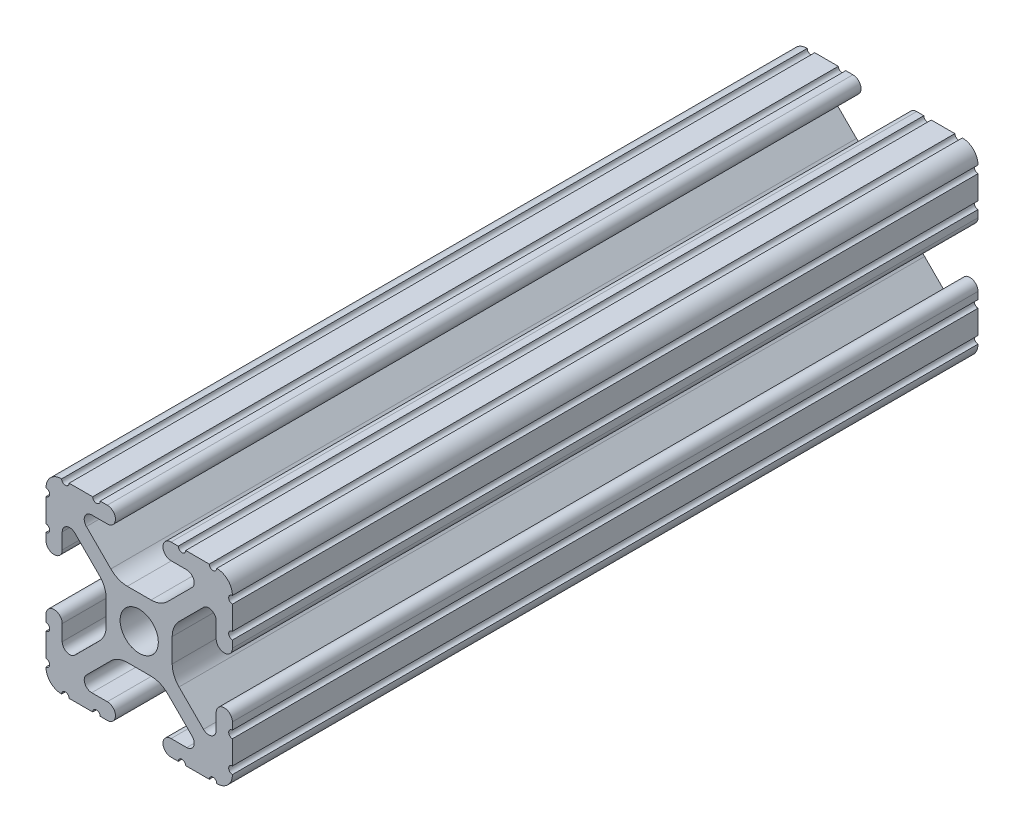
from build123d import *

# Parameters (mm, degrees)
SKETCH1_R           = 2.6035
BOSS_EXTRUDE1_DEPTH = 101.6


with BuildPart() as part:
    # Sketch1 → Boss-Extrude1 (new body)
    with BuildSketch(Plane(origin=(0, 0, -101.6), x_dir=(-1, 0, 0), z_dir=(0, 0, -1))):
        with BuildLine():
            Line((12.7, -9.5504), (12.7, -6.3330836))
            ThreePointArc((12.7, -6.3330836), (12.192, -5.8250836), (12.7, -5.3170836))
            Line((12.7, -5.3170836), (12.7, -4.3434))
            ThreePointArc((12.7, -4.3434), (11.5951, -3.2385), (10.4902, -4.3434))
            Line((10.4902, -4.3434), (10.4902, -6.474794456))
            ThreePointArc((10.4902, -6.474794456), (9.863006367, -7.413456061), (8.75577951, -7.193214945))
            Line((8.75577951, -7.193214945), (5.42573597, -3.863171405))
            ThreePointArc((5.42573597, -3.863171405), (4.737482484, -2.833127272), (4.4958, -1.618107374))
            Line((4.4958, -1.618107374), (4.4958, 1.618107374))
            ThreePointArc((4.4958, 1.618107374), (4.737482484, 2.833127272), (5.42573597, 3.863171405))
            Line((5.42573597, 3.863171405), (8.75577951, 7.193214945))
            ThreePointArc((8.75577951, 7.193214945), (9.863006367, 7.413456061), (10.4902, 6.474794456))
            Line((10.4902, 6.474794456), (10.4902, 4.343399971))
            ThreePointArc((10.4902, 4.343399971), (11.5951, 3.238499971), (12.7, 4.343399971))
            Line((12.7, 4.343399971), (12.7, 5.3170836))
            ThreePointArc((12.7, 5.3170836), (12.192, 5.8250836), (12.7, 6.3330836))
            Line((12.7, 6.3330836), (12.7, 9.5504))
            ThreePointArc((12.7, 9.5504), (12.192000006, 10.058323491), (12.699846982, 10.566399977))
            ThreePointArc((12.699846982, 10.566399977), (12.082522516, 12.082522516), (10.566399977, 12.699846982))
            ThreePointArc((10.566399977, 12.699846982), (10.058323491, 12.192000006), (9.5504, 12.7))
            Line((9.5504, 12.7), (6.3330836, 12.7))
            ThreePointArc((6.3330836, 12.7), (5.8250836, 12.192), (5.3170836, 12.7))
            Line((5.3170836, 12.7), (4.3434, 12.7))
            ThreePointArc((4.3434, 12.7), (3.2385, 11.5951), (4.3434, 10.4902))
            Line((4.3434, 10.4902), (6.474794456, 10.4902))
            ThreePointArc((6.474794456, 10.4902), (7.413456061, 9.863006367), (7.193214945, 8.75577951))
            Line((7.193214945, 8.75577951), (3.863171405, 5.42573597))
            ThreePointArc((3.863171405, 5.42573597), (2.833127272, 4.737482484), (1.618107374, 4.4958))
            Line((1.618107374, 4.4958), (-1.618107374, 4.4958))
            ThreePointArc((-1.618107374, 4.4958), (-2.833127272, 4.737482484), (-3.863171405, 5.42573597))
            Line((-3.863171405, 5.42573597), (-7.193214945, 8.75577951))
            ThreePointArc((-7.193214945, 8.75577951), (-7.413456061, 9.863006367), (-6.474794456, 10.4902))
            Line((-6.474794456, 10.4902), (-4.343399971, 10.4902))
            ThreePointArc((-4.343399971, 10.4902), (-3.238499971, 11.5951), (-4.343399971, 12.7))
            Line((-4.343399971, 12.7), (-5.3170836, 12.7))
            ThreePointArc((-5.3170836, 12.7), (-5.8250836, 12.192), (-6.3330836, 12.7))
            Line((-6.3330836, 12.7), (-9.5504, 12.7))
            ThreePointArc((-9.5504, 12.7), (-10.058323491, 12.192000006), (-10.566399977, 12.699846982))
            ThreePointArc((-10.566399977, 12.699846982), (-12.082522516, 12.082522516), (-12.699846982, 10.566399977))
            ThreePointArc((-12.699846982, 10.566399977), (-12.192000006, 10.058323491), (-12.7, 9.5504))
            Line((-12.7, 9.5504), (-12.7, 6.3330836))
            ThreePointArc((-12.7, 6.3330836), (-12.192, 5.8250836), (-12.7, 5.3170836))
            Line((-12.7, 5.3170836), (-12.7, 4.3434))
            ThreePointArc((-12.7, 4.3434), (-11.5951, 3.2385), (-10.4902, 4.3434))
            Line((-10.4902, 4.3434), (-10.4902, 6.474794456))
            ThreePointArc((-10.4902, 6.474794456), (-9.863006367, 7.413456061), (-8.75577951, 7.193214945))
            Line((-8.75577951, 7.193214945), (-5.42573597, 3.863171405))
            ThreePointArc((-5.42573597, 3.863171405), (-4.737482484, 2.833127272), (-4.4958, 1.618107374))
            Line((-4.4958, 1.618107374), (-4.4958, -1.618107374))
            ThreePointArc((-4.4958, -1.618107374), (-4.737482484, -2.833127272), (-5.42573597, -3.863171405))
            Line((-5.42573597, -3.863171405), (-8.75577951, -7.193214945))
            ThreePointArc((-8.75577951, -7.193214945), (-9.863006367, -7.413456061), (-10.4902, -6.474794456))
            Line((-10.4902, -6.474794456), (-10.4902, -4.343399971))
            ThreePointArc((-10.4902, -4.343399971), (-11.5951, -3.238499971), (-12.7, -4.343399971))
            Line((-12.7, -4.343399971), (-12.7, -5.3170836))
            ThreePointArc((-12.7, -5.3170836), (-12.192, -5.8250836), (-12.7, -6.3330836))
            Line((-12.7, -6.3330836), (-12.7, -9.5504))
            ThreePointArc((-12.7, -9.5504), (-12.192000006, -10.058323491), (-12.699846982, -10.566399977))
            ThreePointArc((-12.699846982, -10.566399977), (-12.082522516, -12.082522516), (-10.566399977, -12.699846982))
            ThreePointArc((-10.566399977, -12.699846982), (-10.058323491, -12.192000006), (-9.5504, -12.7))
            Line((-9.5504, -12.7), (-6.3330836, -12.7))
            ThreePointArc((-6.3330836, -12.7), (-5.8250836, -12.192), (-5.3170836, -12.7))
            Line((-5.3170836, -12.7), (-4.3434, -12.7))
            ThreePointArc((-4.3434, -12.7), (-3.2385, -11.5951), (-4.3434, -10.4902))
            Line((-4.3434, -10.4902), (-6.474794456, -10.4902))
            ThreePointArc((-6.474794456, -10.4902), (-7.413456061, -9.863006367), (-7.193214945, -8.75577951))
            Line((-7.193214945, -8.75577951), (-3.863171405, -5.42573597))
            ThreePointArc((-3.863171405, -5.42573597), (-2.833127272, -4.737482484), (-1.618107374, -4.4958))
            Line((-1.618107374, -4.4958), (1.618107374, -4.4958))
            ThreePointArc((1.618107374, -4.4958), (2.833127272, -4.737482484), (3.863171405, -5.42573597))
            Line((3.863171405, -5.42573597), (7.193214945, -8.75577951))
            ThreePointArc((7.193214945, -8.75577951), (7.413456061, -9.863006367), (6.474794456, -10.4902))
            Line((6.474794456, -10.4902), (4.343399971, -10.4902))
            ThreePointArc((4.343399971, -10.4902), (3.238499971, -11.5951), (4.343399971, -12.7))
            Line((4.343399971, -12.7), (5.3170836, -12.7))
            ThreePointArc((5.3170836, -12.7), (5.8250836, -12.192), (6.3330836, -12.7))
            Line((6.3330836, -12.7), (9.5504, -12.7))
            ThreePointArc((9.5504, -12.7), (10.058323491, -12.192000006), (10.566399977, -12.699846982))
            ThreePointArc((10.566399977, -12.699846982), (12.082522516, -12.082522516), (12.699846982, -10.566399977))
            ThreePointArc((12.699846982, -10.566399977), (12.192000006, -10.058323491), (12.7, -9.5504))
        make_face()
        with Locations(Location((0, 0, 0), (0, 0, 180))):
            Circle(SKETCH1_R, mode=Mode.SUBTRACT)
    extrude(amount=-BOSS_EXTRUDE1_DEPTH)


solid = part.part
